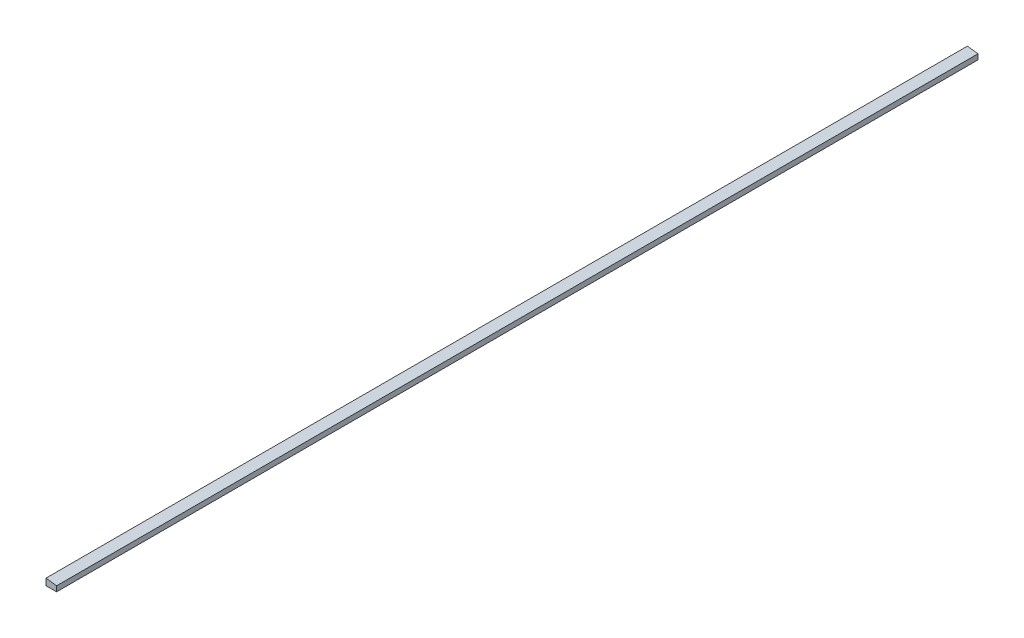
from build123d import *

# Parameters (mm, degrees)
SKIZZE1_W                       = 8
SKIZZE1_H                       = 5
AUFSATZ_LINEAR_AUSTRAGEN1_DEPTH = 695
SCHNITT_LINEAR_AUSTRAGEN1_DEPTH = 696.064025828


with BuildPart() as part:
    # Skizze1 → Aufsatz-Linear austragen1 (new body)
    with BuildSketch(Plane.XY):
        with Locations((4, 2.5)):
            Rectangle(SKIZZE1_W, SKIZZE1_H)
    extrude(amount=AUFSATZ_LINEAR_AUSTRAGEN1_DEPTH)

    # Skizze2 → Schnitt-Linear austragen1 (cut, through all)
    with BuildSketch(Plane.XY.offset(695)):
        Polygon((0, 5), (8, 4), (8, 5), align=None)
    extrude(amount=-SCHNITT_LINEAR_AUSTRAGEN1_DEPTH, mode=Mode.SUBTRACT)


solid = part.part
